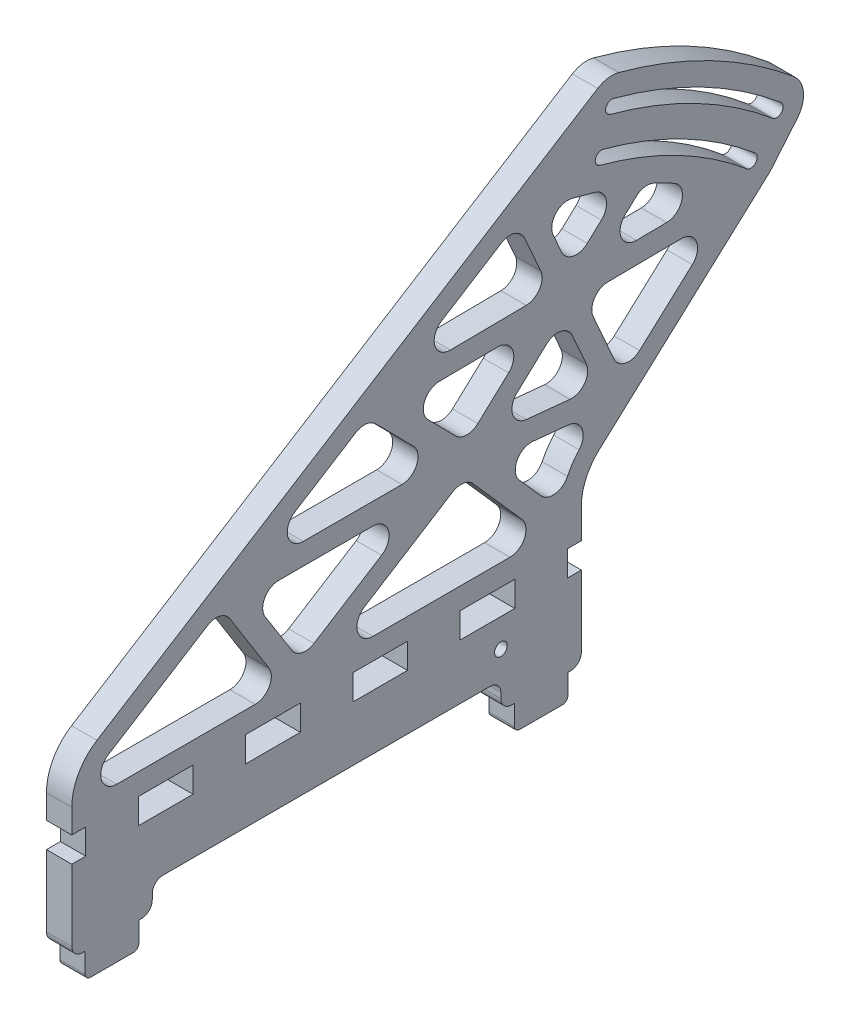
from build123d import *

# Parameters (mm, degrees)
MOUNTING_DEPTH          = 3
SKETCH3_R               = 1.5
BOSS_EXTRUDE2_DEPTH     = 6
PIVOTHOLE_DEPTH         = 133.681535985
PIVOTHOLE_DEPTH_BACK    = 133.681535985
SKETCH3_2_R             = 1.5
SKETCH4_W               = 6
SKETCH4_H               = 12.7
TAB_DEPTH               = 6
FILLET1_R               = 12.7
FILLET2_R               = 2.54
TABFILLET_R             = 1.27
CUT_EXTRUDE2_DEPTH      = 133.681535985
CUT_EXTRUDE2_DEPTH_BACK = 133.681535985
SKETCH5_W               = 12.954
SKETCH5_H               = 6
CUT_EXTRUDE3_DEPTH      = 133.681535985
CUT_EXTRUDE3_DEPTH_BACK = 133.681535985
FILLET4_R               = 3.81


with BuildPart() as part:
    # Sketch2 → Mounting (new, symmetric)
    with BuildSketch(Plane(origin=(0, 0, 0), x_dir=(0, 0, -1), z_dir=(1, 0, 0))):
        Polygon((-60.325, -47.8), (-60.325, -9.7), (60.325, -9.7), (60.325, -47.8), (57.15, -47.8), (44.45, -47.8), (41.275, -47.8), (41.275, -41.45), (-41.275, -41.45), (-41.275, -47.8), (-44.45, -47.8), (-57.15, -47.8), align=None)
    extrude(amount=MOUNTING_DEPTH, both=True)

    # Sketch3 → Boss-Extrude2 (add)
    # profile 1 of 2: a face of its own
    with BuildSketch(Plane(origin=(3, 0, 0), x_dir=(0, 0, -1), z_dir=(1, 0, 0))):
        with Locations((41.275, -35.1)):
            Circle(SKETCH3_R)
    # profile 2 of 2: a face of its own
    with BuildSketch(Plane(origin=(3, 0, 0), x_dir=(0, 0, -1), z_dir=(1, 0, 0))):
        with BuildLine():
            Line((64.196478559, 68.417190639), (-60.325, -9.7))
            Line((-60.325, -9.7), (60.325, -9.7))
            Line((60.325, -9.7), (104.734943372, 30.73838178))
            ThreePointArc((104.734943372, 30.73838178), (105.039779736, 31.035237071), (105.324051376, 31.351840779))
            Line((105.324051376, 31.351840779), (111.446603358, 38.648414099))
            ThreePointArc((111.446603358, 38.648414099), (112.908057477, 43.283554387), (110.663922466, 47.594497635))
            ThreePointArc((110.663922466, 47.594497635), (91.120762799, 60.652819442), (69.214515919, 69.171692948))
            ThreePointArc((69.214515919, 69.171692948), (66.626854298, 69.317479577), (64.196478559, 68.417190639))
        make_face()
        with BuildLine():
            ThreePointArc((107.546402559, 43.879182086), (88.881282025, 56.350816901), (67.95924355, 64.48695269))
            ThreePointArc((67.95924355, 64.48695269), (66.122126243, 63.426292519), (67.182786415, 61.589175212))
            ThreePointArc((67.182786415, 61.589175212), (87.496036185, 53.689784401), (105.61803973, 41.581048756))
            ThreePointArc((105.61803973, 41.581048756), (107.731287809, 41.765934006), (107.546402559, 43.879182086))
        make_face(mode=Mode.SUBTRACT)
        with BuildLine():
            ThreePointArc((101.423850576, 36.582608765), (84.483126483, 47.902038715), (65.493992145, 55.286509195))
            ThreePointArc((65.493992145, 55.286509195), (63.656874838, 54.225849023), (64.71753501, 52.388731716))
            ThreePointArc((64.71753501, 52.388731716), (83.097880644, 45.241006215), (99.495487747, 34.284475436))
            ThreePointArc((99.495487747, 34.284475436), (101.608735827, 34.469360686), (101.423850576, 36.582608765))
        make_face(mode=Mode.SUBTRACT)
    extrude(amount=-BOSS_EXTRUDE2_DEPTH)

    # Sketch3<2> → PivotHole (cut, two sides: drawn at the far end of the back side and taken through both)
    with BuildSketch(Plane(origin=(3, 0, 0), x_dir=(0, 0, -1), z_dir=(1, 0, 0)).offset(-PIVOTHOLE_DEPTH_BACK)):
        with Locations((41.275, -35.1)):
            Circle(SKETCH3_2_R)
    extrude(amount=PIVOTHOLE_DEPTH + PIVOTHOLE_DEPTH_BACK, mode=Mode.SUBTRACT)

    # Sketch4 → Tab (add)
    with BuildSketch(Plane.XZ.offset(47.8)):
        with Locations((0, 50.8)):
            Rectangle(SKETCH4_W, SKETCH4_H)
        with Locations((0, -50.8)):
            Rectangle(SKETCH4_W, SKETCH4_H)
    extrude(amount=TAB_DEPTH)

    # Fillet1
    fillet1_edges = [part.edges().sort_by_distance(p)[0] for p in [
        (0, -9.7, 60.325),
        (0, -9.7, -60.325),
    ]]
    fillet(fillet1_edges, radius=FILLET1_R)

    # Fillet2
    fillet2_edges = [part.edges().sort_by_distance(p)[0] for p in [
        (0, -47.8, 60.325),
        (0, -47.8, -60.325),
        (0, -47.8, -41.275),
        (0, -41.45, -41.275),
        (0, -41.45, 41.275),
        (0, -47.8, 41.275),
    ]]
    fillet(fillet2_edges, radius=FILLET2_R)

    # TabFillet
    tabfillet_edges = [part.edges().sort_by_distance(p)[0] for p in [
        (0, -53.8, 57.15),
        (0, -53.8, 44.45),
        (0, -53.8, -44.45),
        (0, -53.8, -57.15),
    ]]
    fillet(tabfillet_edges, radius=TABFILLET_R)

    # Sketch5 → Cut-Extrude2 (cut, two sides: drawn at the far end of the back side and taken through both)
    with BuildSketch(Plane(origin=(3, 0, 0), x_dir=(0, 0, -1), z_dir=(1, 0, 0)).offset(-CUT_EXTRUDE2_DEPTH_BACK)):
        with Locations((-88.9, -25.4)):
            Rectangle(SKETCH5_W, SKETCH5_H)
        with Locations((-63.5, -25.4)):
            Rectangle(SKETCH5_W, SKETCH5_H)
        with Locations((-38.1, -25.4)):
            Rectangle(SKETCH5_W, SKETCH5_H)
        with Locations((-12.7, -25.4)):
            Rectangle(SKETCH5_W, SKETCH5_H)
        with Locations((12.7, -25.4)):
            Rectangle(SKETCH5_W, SKETCH5_H)
        with Locations((38.1, -25.4)):
            Rectangle(SKETCH5_W, SKETCH5_H)
        with Locations((63.5, -25.4)):
            Rectangle(SKETCH5_W, SKETCH5_H)
        with Locations((88.9, -25.4)):
            Rectangle(SKETCH5_W, SKETCH5_H)
    extrude(amount=CUT_EXTRUDE2_DEPTH + CUT_EXTRUDE2_DEPTH_BACK, mode=Mode.SUBTRACT)

    # Sketch7 → Cut-Extrude3 (cut, two sides: drawn at the far end of the back side and taken through both)
    with BuildSketch(Plane(origin=(3, 0, 0), x_dir=(0, 0, -1), z_dir=(1, 0, 0)).offset(-CUT_EXTRUDE3_DEPTH_BACK)):
        with BuildLine():
            Line((-10.006967223, -17.32), (-24.947987595, 6.496498425))
            Line((-24.947987595, 6.496498425), (-51.674443709, -10.270052145))
            ThreePointArc((-51.674443709, -10.270052145), (-54.292876763, -13.036668575), (-55.245, -16.725004171))
            Line((-55.245, -16.725004171), (-55.245, -17.32))
            Line((-55.245, -17.32), (-51.943, -17.32))
            Line((-51.943, -17.32), (-10.006967223, -17.32))
        make_face()
        Polygon((32.550505315, 4.547203969), (-2.235860868, -17.32), (51.856708498, -17.32), align=None)
        Polygon((9.484126296, 28.097109308), (-18.747489887, 10.386312995), (26.953087144, 10.386312995), align=None)
        Polygon((17.697155957, 27.004484625), (33.105860164, 11.382466577), (50.351886773, 27.357230881), align=None)
        Polygon((56.02211899, 25.685007868), (38.890684633, 9.816388838), (64.130364826, 7.309820294), align=None)
        Polygon((24.212768099, 5.306312995), (-18.204453525, 5.306312995), (-6.207923956, -13.816566198), align=None)
        with BuildLine():
            Line((65.684309288, 2.050507547), (39.210131967, 4.679674779))
            Line((39.210131967, 4.679674779), (55.329730641, -13.578216157))
            ThreePointArc((55.329730641, -13.578216157), (57.132204748, -7.340286662), (61.054232213, -2.165503782))
            Line((61.054232213, -2.165503782), (65.684309288, 2.050507547))
        make_face()
        Polygon((60.787076052, 27.469954945), (70.192350366, 6.155396506), (93.994212294, 27.828668451), align=None)
        Polygon((45.098877949, 50.439635085), (15.808083229, 32.064374675), (53.029734091, 32.466454179), align=None)
        with BuildLine():
            Line((50.42182162, 50.960053578), (57.794691153, 34.251401255))
            Line((57.794691153, 34.251401255), (69.897016402, 45.461623631))
            ThreePointArc((69.897016402, 45.461623631), (66.669972043, 46.53633027), (63.402734261, 47.481828519))
            Line((63.402734261, 47.481828519), (50.42182162, 50.960053578))
        make_face()
        with BuildLine():
            Line((75.146119208, 43.399314065), (63.46492337, 32.579178243))
            Line((63.46492337, 32.579178243), (93.096754828, 32.899270228))
            ThreePointArc((93.096754828, 32.899270228), (84.441884243, 38.697121419), (75.146119208, 43.399314065))
        make_face()
    extrude(amount=CUT_EXTRUDE3_DEPTH + CUT_EXTRUDE3_DEPTH_BACK, mode=Mode.SUBTRACT)

    # Fillet4
    fillet4_edges = [part.edges().sort_by_distance(p)[0] for p in [
        (0, 32.899270228, -93.096754828),
        (0, 43.399314065, -75.146119208),
        (0, 32.579178243, -63.46492337),
        (0, 45.461623631, -69.897016402),
        (0, 50.960053578, -50.42182162),
        (0, 34.251401255, -57.794691153),
        (0, 50.439635085, -45.098877949),
        (0, 32.064374675, -15.808083229),
        (0, 32.466454179, -53.029734091),
        (0, 6.155396506, -70.192350366),
        (0, 27.828668451, -93.994212294),
        (0, 27.469954945, -60.787076052),
        (0, 2.050507547, -65.684309288),
        (0, 4.679674779, -39.210131967),
        (0, -13.578216157, -55.329730641),
        (0, 5.306312995, 18.204453525),
        (0, -13.816566198, 6.207923956),
        (0, 5.306312995, -24.212768099),
        (0, 9.816388838, -38.890684633),
        (0, 7.309820294, -64.130364826),
        (0, 25.685007868, -56.02211899),
        (0, 11.382466577, -33.105860164),
        (0, 27.357230881, -50.351886773),
        (0, 27.004484625, -17.697155957),
        (0, 28.097109308, -9.484126296),
        (0, 10.386312995, 18.747489887),
        (0, 10.386312995, -26.953087144),
        (0, -17.32, 2.235860868),
        (0, 4.547203969, -32.550505315),
        (0, -17.32, 55.245),
        (0, -17.32, 10.006967223),
        (0, 6.496498425, 24.947987595),
        (0, -17.32, -51.856708498),
    ]]
    fillet(fillet4_edges, radius=FILLET4_R)


solid = part.part
